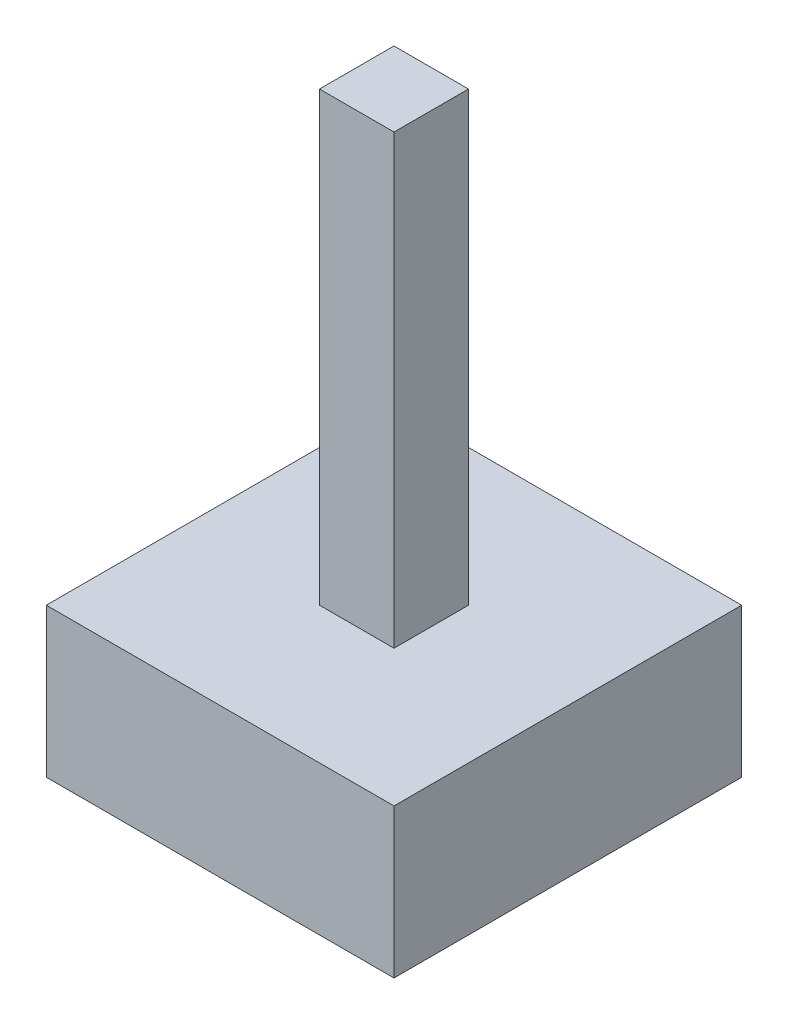
from build123d import *

# Parameters (mm, degrees)
SKETCH1_W           = 8.89
SKETCH1_H           = 8.89
BOSS_EXTRUDE1_DEPTH = 3.81
SKETCH2_W           = 1.905
SKETCH2_H           = 1.905
BOSS_EXTRUDE2_DEPTH = 11.43


with BuildPart() as part:
    # Sketch1 → Boss-Extrude1 (new body)
    with BuildSketch(Plane(origin=(0, 0, 0), x_dir=(1, 0, 0), z_dir=(0, 1, 0))):
        with Locations((4.445, 4.445)):
            Rectangle(SKETCH1_W, SKETCH1_H)
    extrude(amount=BOSS_EXTRUDE1_DEPTH)

    # Sketch2 → Boss-Extrude2 (add)
    with BuildSketch(Plane(origin=(0, 3.81, 0), x_dir=(1, 0, 0), z_dir=(0, 1, 0))):
        with Locations((4.445, 4.445)):
            Rectangle(SKETCH2_W, SKETCH2_H)
    extrude(amount=BOSS_EXTRUDE2_DEPTH)


solid = part.part
